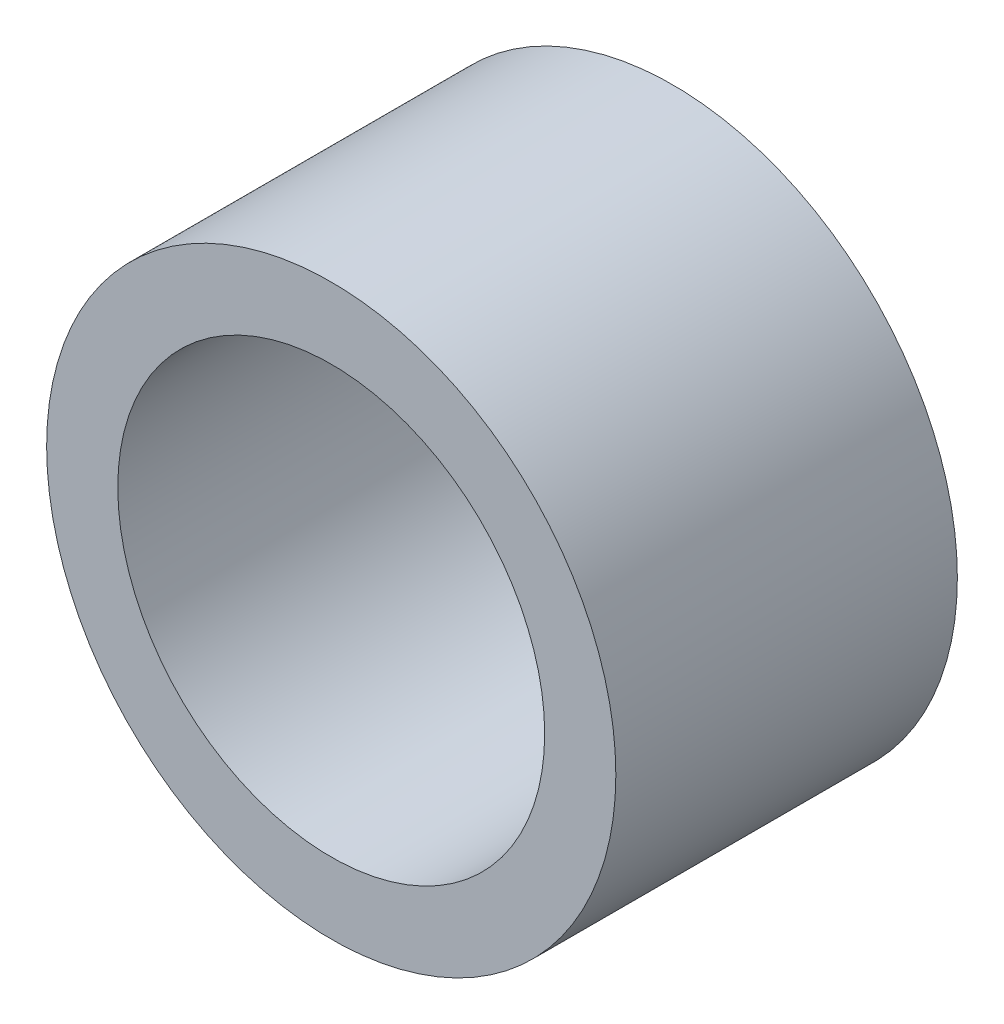
from build123d import *

# Parameters (mm, degrees)
ESQUISSE1_R        = 10
ESQUISSE1_R_2      = 7.5
BOSS_EXTRU_1_DEPTH = 12


with BuildPart() as part:
    # Esquisse1 → Boss.-Extru.1 (new body)
    with BuildSketch(Plane.XY):
        Circle(ESQUISSE1_R)
        Circle(ESQUISSE1_R_2, mode=Mode.SUBTRACT)
    extrude(amount=BOSS_EXTRU_1_DEPTH)


solid = part.part
